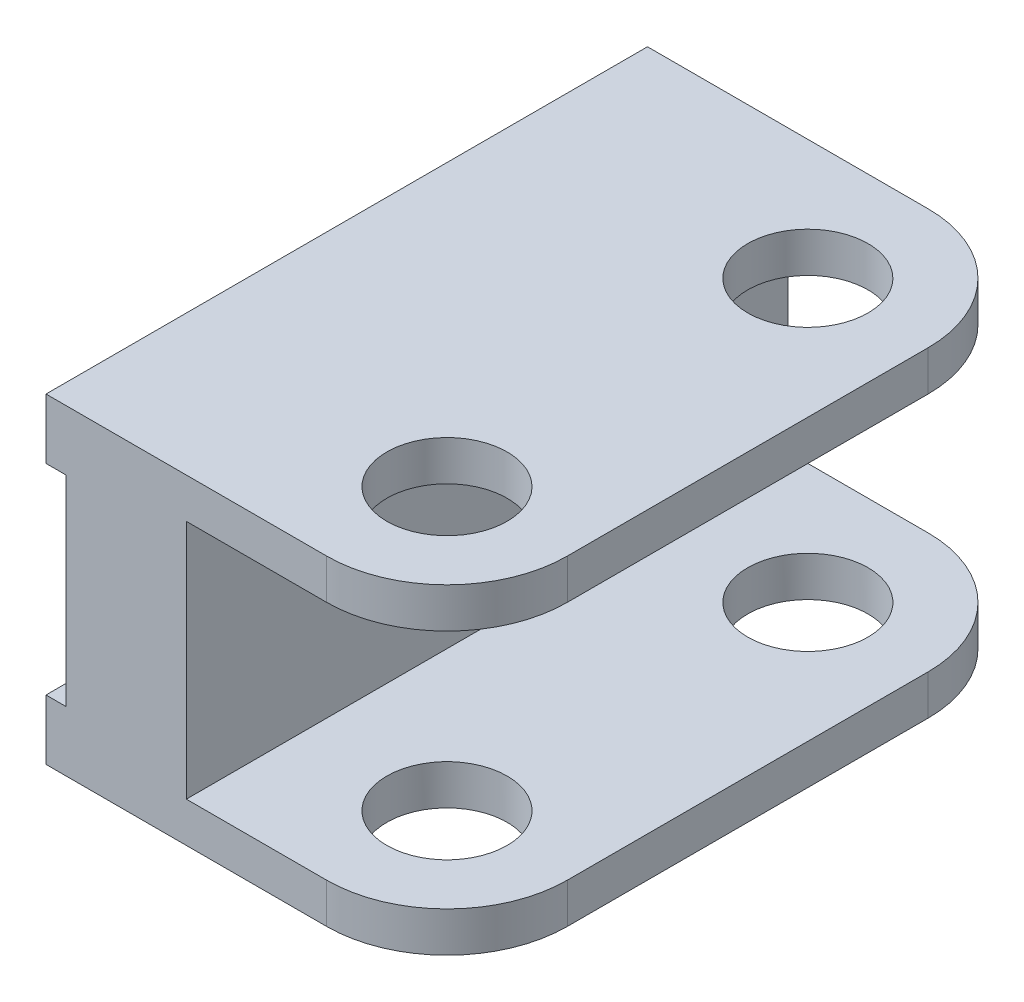
from build123d import *

# Parameters (mm, degrees)
BOSS_EXTRUDE1_DEPTH = 150
SKETCH2_W           = 5
SKETCH2_H           = 50
CUT_EXTRUDE1_DEPTH  = 150
SKETCH3_R           = 15
CUT_EXTRUDE2_DEPTH  = 150
FILLET1_R           = 30


with BuildPart() as part:
    # Sketch1 → Boss-Extrude1 (new body)
    with BuildSketch(Plane.XY):
        Polygon((0, 0), (35, 0), (100, 0), (100, 10), (35, 10), (35, 70), (100, 70), (100, 80), (35, 80), (0, 80), align=None)
    extrude(amount=BOSS_EXTRUDE1_DEPTH)

    # Sketch2 → Cut-Extrude1 (cut)
    with BuildSketch(Plane.XY.offset(150)):
        with Locations((2.5, 40)):
            Rectangle(SKETCH2_W, SKETCH2_H)
    extrude(amount=-CUT_EXTRUDE1_DEPTH, mode=Mode.SUBTRACT)

    # Sketch3 → Cut-Extrude2 (cut)
    with BuildSketch(Plane(origin=(0, 80, 0), x_dir=(1, 0, 0), z_dir=(0, 1, 0))):
        with Locations(Location((70, -30, 0), (0, 0, 270))):
            Circle(SKETCH3_R)
        with Locations(Location((70, -120, 0), (0, 0, 270))):
            Circle(SKETCH3_R)
    extrude(amount=-CUT_EXTRUDE2_DEPTH, mode=Mode.SUBTRACT)

    # Fillet1
    fillet1_edges = [part.edges().sort_by_distance(p)[0] for p in [
        (100, 75, 0),
        (100, 5, 0),
        (100, 5, 150),
        (100, 75, 150),
    ]]
    fillet(fillet1_edges, radius=FILLET1_R)


solid = part.part
